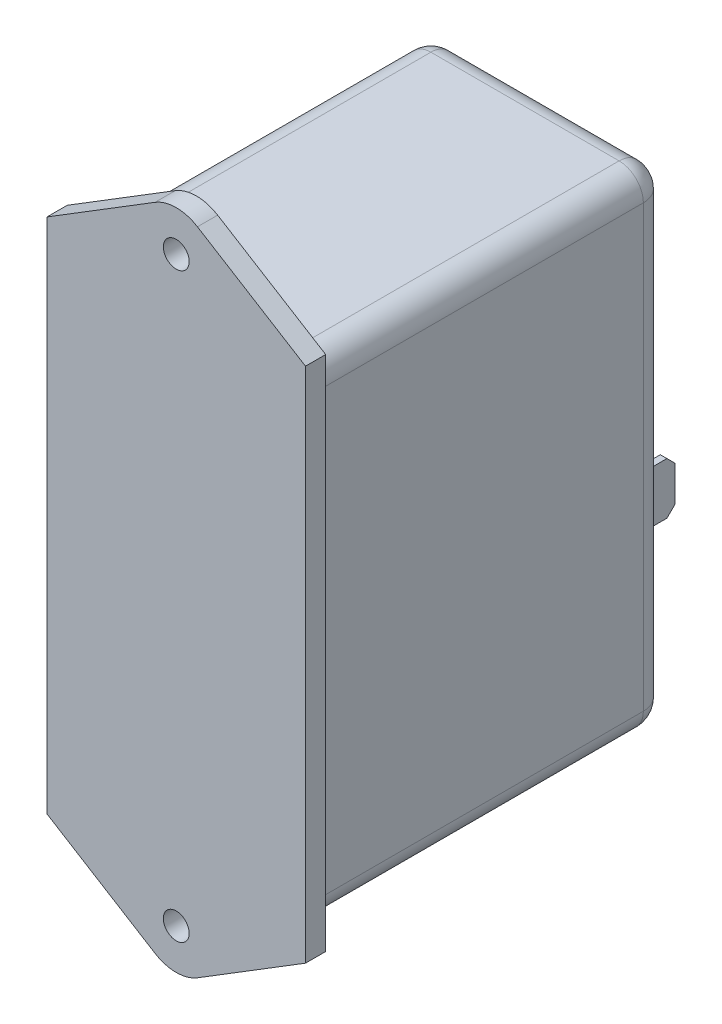
from build123d import *

# Parameters (mm, degrees)
SKETCH1_W           = 29.3
SKETCH1_H           = 60.5
BOSS_EXTRUDE1_DEPTH = 43.67
SKETCH2_R           = 1.6
BOSS_EXTRUDE2_DEPTH = 2.5
FILLET1_R           = 3
SKETCH3_W           = 21
SKETCH3_H           = 13
BOSS_EXTRUDE3_DEPTH = 2
SKETCH4_W           = 0.82
SKETCH4_H           = 6.4
BOSS_EXTRUDE4_DEPTH = 7.85
SKETCH5_W           = 6.4
SKETCH5_H           = 0.82
BOSS_EXTRUDE5_DEPTH = 9.85
CHAMFER1_SIZE       = 1


with BuildPart() as part:
    # Sketch1 → Boss-Extrude1 (new body)
    with BuildSketch(Plane.XY):
        Rectangle(SKETCH1_W, SKETCH1_H)
    extrude(amount=BOSS_EXTRUDE1_DEPTH)

    # Sketch2 → Boss-Extrude2 (add)
    with BuildSketch(Plane.XY.offset(43.67)):
        with BuildLine():
            Line((-16, 32), (-2.62619365, 40.254774602))
            ThreePointArc((-2.62619365, 40.254774602), (0, 41), (2.62619365, 40.254774602))
            Line((2.62619365, 40.254774602), (16, 32))
            Line((16, 32), (16, -32))
            Line((16, -32), (2.62619365, -40.254774602))
            ThreePointArc((2.62619365, -40.254774602), (0, -41), (-2.62619365, -40.254774602))
            Line((-2.62619365, -40.254774602), (-16, -32))
            Line((-16, -32), (-16, 32))
        make_face()
        with Locations((0, 36)):
            Circle(SKETCH2_R, mode=Mode.SUBTRACT)
        with Locations(Location((0, -36, 0), (0, 0, 180))):
            Circle(SKETCH2_R, mode=Mode.SUBTRACT)
    extrude(amount=BOSS_EXTRUDE2_DEPTH)

    # Fillet1
    fillet1_edges = [part.edges().sort_by_distance(p)[0] for p in [
        (0, -30.25, 0),
        (-14.65, 0, 0),
        (0, 30.25, 0),
        (14.65, 0, 0),
        (14.65, -30.25, 21.835),
        (-14.65, -30.25, 21.835),
        (-14.65, 30.25, 21.835),
        (14.65, 30.25, 21.835),
    ]]
    fillet(fillet1_edges, radius=FILLET1_R)

    # Sketch3 → Boss-Extrude3 (add)
    with BuildSketch(Plane(origin=(0, 0, 0), x_dir=(-1, 0, 0), z_dir=(0, 0, -1))):
        with Locations((0, -13.75)):
            Rectangle(SKETCH3_W, SKETCH3_H)
    extrude(amount=BOSS_EXTRUDE3_DEPTH)

    # Sketch4 → Boss-Extrude4 (add)
    with BuildSketch(Plane(origin=(0, 0, -2), x_dir=(-1, 0, 0), z_dir=(0, 0, -1))):
        with Locations((-5.31, -13.75)):
            Rectangle(SKETCH4_W, SKETCH4_H)
        with Locations((5.31, -13.75)):
            Rectangle(SKETCH4_W, SKETCH4_H)
    extrude(amount=BOSS_EXTRUDE4_DEPTH)

    # Sketch5 → Boss-Extrude5 (add)
    with BuildSketch(Plane(origin=(0, 0, 0), x_dir=(-1, 0, 0), z_dir=(0, 0, -1))):
        with Locations((0, -25.46)):
            Rectangle(SKETCH5_W, SKETCH5_H)
    extrude(amount=BOSS_EXTRUDE5_DEPTH)

    # Chamfer1
    chamfer1_edges = [part.edges().sort_by_distance(p)[0] for p in [
        (-5.31, -16.95, -9.85),
        (-5.31, -10.55, -9.85),
        (-3.2, -25.46, -9.85),
        (3.2, -25.46, -9.85),
        (5.31, -16.95, -9.85),
        (5.31, -10.55, -9.85),
    ]]
    chamfer(chamfer1_edges, length=CHAMFER1_SIZE)


solid = part.part
